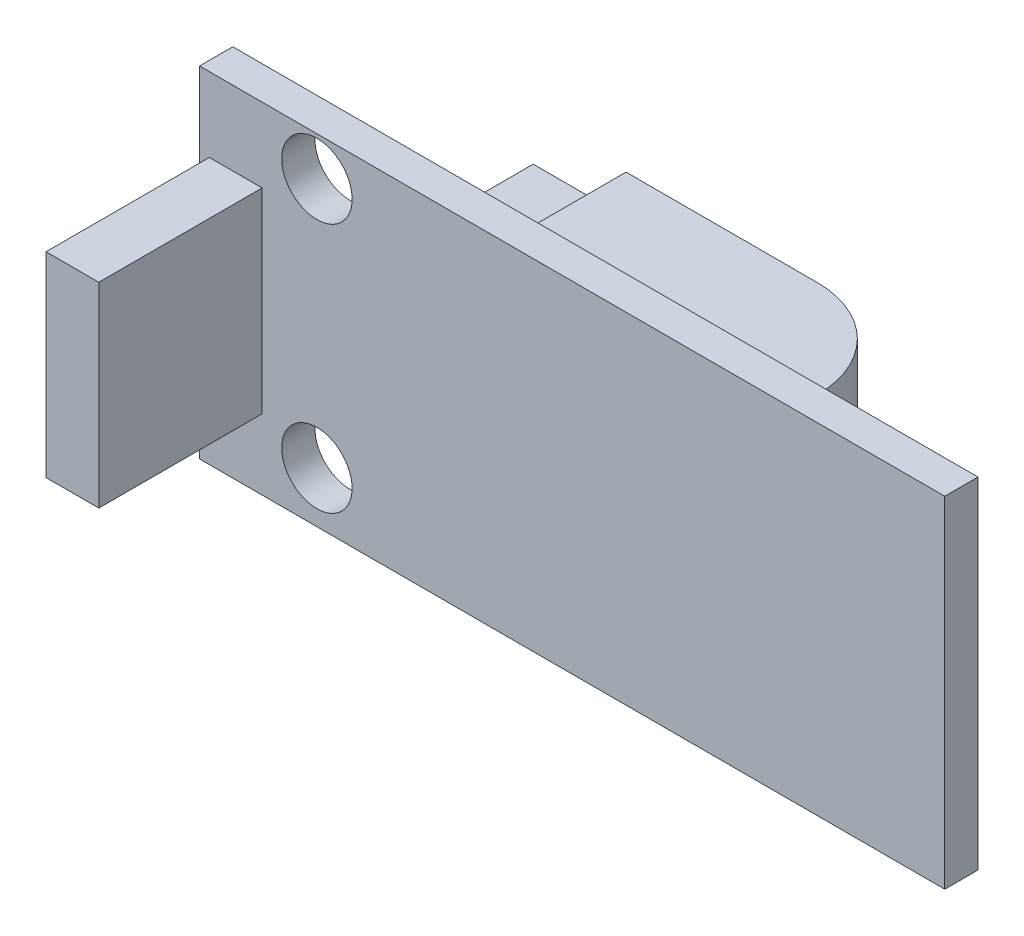
from build123d import *

# Parameters (mm, degrees)
CROQUIS1_W                   = 17.4
CROQUIS1_H                   = 38.1
CROQUIS1_R                   = 1.8
SALIENTE_EXTRUIR1_DEPTH      = 1.7
SALIENTE_EXTRUIR2_DEPTH      = 8.35
SALIENTE_EXTRUIR2_DEPTH_BACK = 2.35
CROQUIS2_W                   = 2.7
CROQUIS2_H                   = 10
SALIENTE_EXTRUIR3_DEPTH      = 7
REDONDEO2_R                  = 5


with BuildPart() as part:
    # Croquis1 → Saliente-Extruir1 (new body)
    with BuildSketch(Plane(origin=(0, 0, 0), x_dir=(0, 1, 0), z_dir=(0, 0, 1))):
        Rectangle(CROQUIS1_W, CROQUIS1_H)
        with Locations(Location((6.7, 13.05, 0), (0, 0, 270))):
            Circle(CROQUIS1_R, mode=Mode.SUBTRACT)
        with Locations(Location((-6.1, 13.05, 0), (0, 0, 270))):
            Circle(CROQUIS1_R, mode=Mode.SUBTRACT)
    extrude(amount=SALIENTE_EXTRUIR1_DEPTH)

    # Croquis2 → Saliente-Extruir2 (add, two sides: drawn at the far end of the back side and taken through both)
    with BuildSketch(Plane.XY.offset(1.7).offset(-SALIENTE_EXTRUIR2_DEPTH_BACK)):
        with Locations((-17.2, -0.1)):
            Rectangle(CROQUIS2_W, CROQUIS2_H)
    extrude(amount=SALIENTE_EXTRUIR2_DEPTH + SALIENTE_EXTRUIR2_DEPTH_BACK)

    # Croquis3 → Saliente-Extruir3 (add)
    with BuildSketch(Plane(origin=(0, 0, 0), x_dir=(1, 0, 0), z_dir=(0, 0, -1))):
        Polygon((-10.690625063, -4.182266508), (-5.944457453, -4.182266508), (-5.944457453, -6.202912125), (8.810954722, -6.202912125), (8.810954722, -2.396579685), (1.715199186, -2.396579685), (1.715199186, 2.490563202), (8.810954722, 2.490563202), (8.810954722, 6.108928608), (-5.850473936, 6.108928608), (-5.850473936, 4.464217059), (-10.690625063, 4.464217059), align=None)
    extrude(amount=SALIENTE_EXTRUIR3_DEPTH)

    # Redondeo2
    redondeo2_edges = [part.edges().sort_by_distance(p)[0] for p in [
        (8.810954722, 4.299745905, -7),
        (8.810954722, -4.299745905, -7),
    ]]
    fillet(redondeo2_edges, radius=REDONDEO2_R)


solid = part.part
